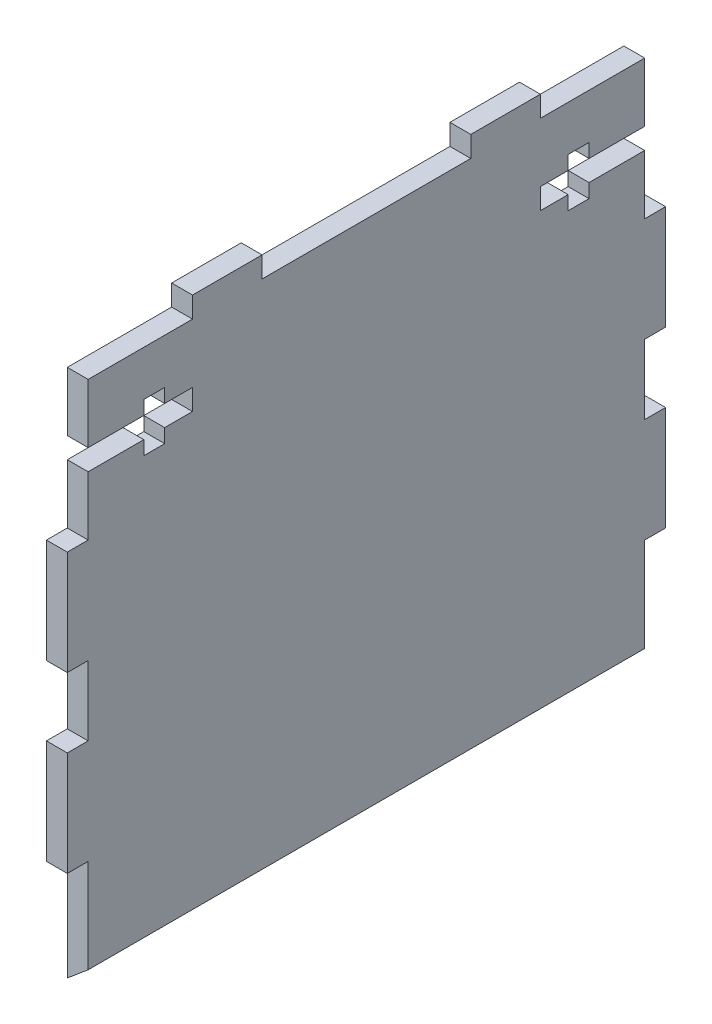
from build123d import *

# Parameters (mm, degrees)
SALIENTE_EXTRUIR1_DEPTH = 80
CROQUIS2_W              = 3
CROQUIS2_H              = 15
SALIENTE_EXTRUIR2_DEPTH = 3
CROQUIS3_W              = 3
CROQUIS3_H              = 15
SALIENTE_EXTRUIR3_DEPTH = 3
CORTAR_EXTRUIR1_DEPTH   = 10
CROQUIS5_W              = 10
CROQUIS5_H              = 3
SALIENTE_EXTRUIR4_DEPTH = 3


with BuildPart() as part:
    # Croquis1 → Saliente-Extruir1 (new body)
    with BuildSketch(Plane.XY):
        Polygon((3, 0), (3, -63.5), (0, -66.017298894), (0, 0), (0, 10), (3, 10), align=None)
    extrude(amount=SALIENTE_EXTRUIR1_DEPTH)

    # Croquis2 → Saliente-Extruir2 (add)
    with BuildSketch(Plane.XY.offset(80)):
        with Locations((1.5, -17.5)):
            Rectangle(CROQUIS2_W, CROQUIS2_H)
        with Locations((1.5, -42.5)):
            Rectangle(CROQUIS2_W, CROQUIS2_H)
    extrude(amount=SALIENTE_EXTRUIR2_DEPTH)

    # Croquis3 → Saliente-Extruir3 (add)
    with BuildSketch(Plane(origin=(0, 0, 0), x_dir=(-1, 0, 0), z_dir=(0, 0, -1))):
        with Locations((-1.5, -17.5)):
            Rectangle(CROQUIS3_W, CROQUIS3_H)
        with Locations((-1.5, -42.5)):
            Rectangle(CROQUIS3_W, CROQUIS3_H)
    extrude(amount=SALIENTE_EXTRUIR3_DEPTH)

    # Croquis4 → Cortar-Extruir1 (cut)
    with BuildSketch(Plane.ZY):
        Polygon((0, 1.5), (8, 1.5), (8, 3.5), (11, 3.5), (11, 1.5), (15, 1.5), (15, -1.5), (11, -1.5), (11, -3.5), (8, -3.5), (8, -1.5), (0, -1.5), align=None)
        Polygon((69, -1.5), (65, -1.5), (65, 1.5), (69, 1.5), (69, 3.5), (72, 3.5), (72, 1.5), (80, 1.5), (80, -1.5), (72, -1.5), (72, -3.5), (69, -3.5), align=None)
    extrude(amount=-CORTAR_EXTRUIR1_DEPTH, mode=Mode.SUBTRACT)

    # Croquis5 → Saliente-Extruir4 (add)
    with BuildSketch(Plane.ZY):
        with Locations((20, 11.5)):
            Rectangle(CROQUIS5_W, CROQUIS5_H)
        with Locations((60, 11.5)):
            Rectangle(CROQUIS5_W, CROQUIS5_H)
    extrude(amount=-SALIENTE_EXTRUIR4_DEPTH)


solid = part.part
